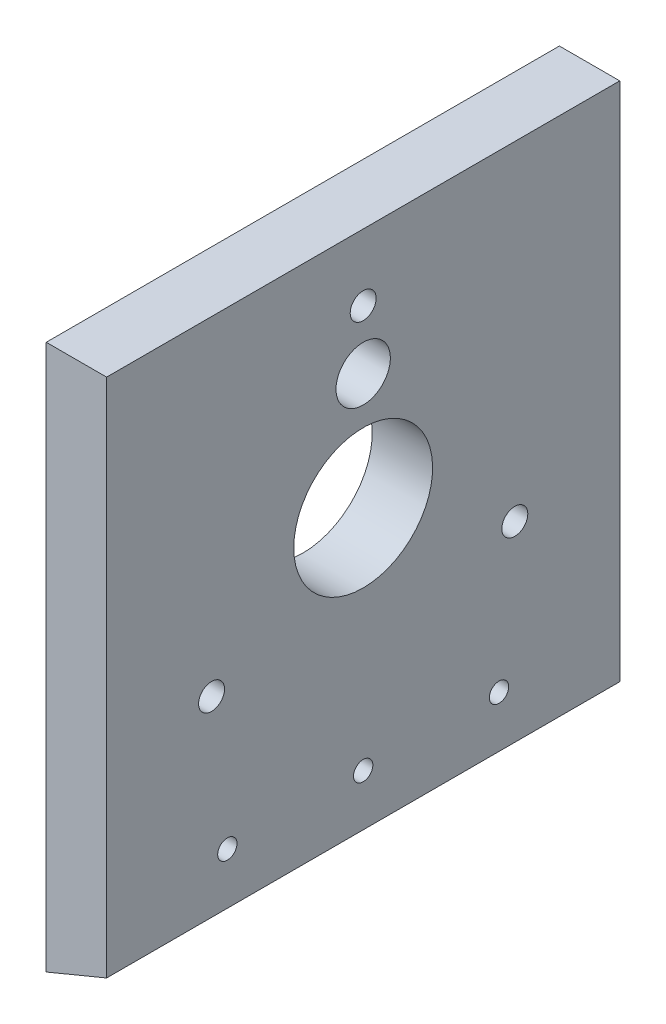
from build123d import *

# Parameters (mm, degrees)
BOSS_EXTRUDE1_DEPTH = 85
SKETCH3_R           = 11.5
SKETCH3_R_2         = 4.5
SKETCH3_R_3         = 2.15
CUT_EXTRUDE1_DEPTH  = 85
SKETCH4_R           = 1.6
CUT_EXTRUDE2_DEPTH  = 85


with BuildPart() as part:
    # Sketch2 → Boss-Extrude1 (new body)
    with BuildSketch(Plane.XY):
        Polygon((0, 0), (0, 86.2), (-10, 86.2), (-10, -4.142135624), align=None)
    extrude(amount=BOSS_EXTRUDE1_DEPTH)

    # Sketch3 → Cut-Extrude1 (cut)
    with BuildSketch(Plane.ZY.offset(10)):
        with Locations(Location((42.5, 46.2, 0), (0, 0, 270))):
            Circle(SKETCH3_R)
        with Locations(Location((42.5, 65.45, 0), (0, 0, 270))):
            Circle(SKETCH3_R_2)
        with Locations(Location((42.5, 75.2, 0), (0, 0, 270))):
            Circle(SKETCH3_R_3)
        with Locations(Location((67.61473671, 31.7, 0), (0, 0, 270))):
            Circle(SKETCH3_R_3)
        with Locations(Location((17.38526329, 31.7, 0), (0, 0, 270))):
            Circle(SKETCH3_R_3)
    extrude(amount=-CUT_EXTRUDE1_DEPTH, mode=Mode.SUBTRACT)

    # Sketch4 → Cut-Extrude2 (cut)
    with BuildSketch(Plane(origin=(0, 0, 0), x_dir=(0, 0, -1), z_dir=(1, 0, 0))):
        with Locations((-65, 8.5)):
            Circle(SKETCH4_R)
        with Locations((-20, 8.5)):
            Circle(SKETCH4_R)
        with Locations((-42.5, 8.5)):
            Circle(SKETCH4_R)
    extrude(amount=-CUT_EXTRUDE2_DEPTH, mode=Mode.SUBTRACT)


solid = part.part
